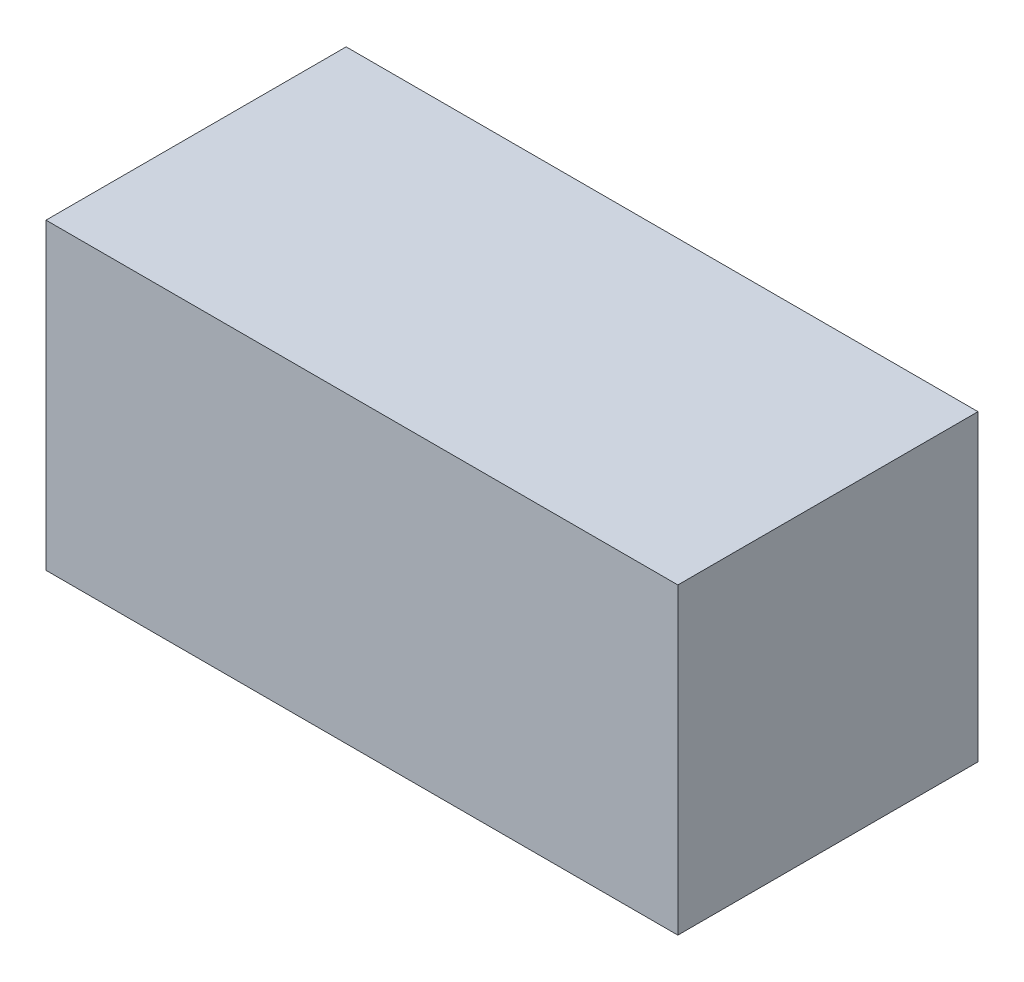
from build123d import *

# Parameters (mm, degrees)
SKETCH_1_W              = 2
SKETCH_1_H              = 0.96
COMPONENT_OUTLINE_DEPTH = 0.95


with BuildPart() as part:
    # 草图1 → Component_Outline (new body)
    with BuildSketch(Plane.XY):
        Rectangle(SKETCH_1_W, SKETCH_1_H)
    extrude(amount=COMPONENT_OUTLINE_DEPTH)


solid = part.part
